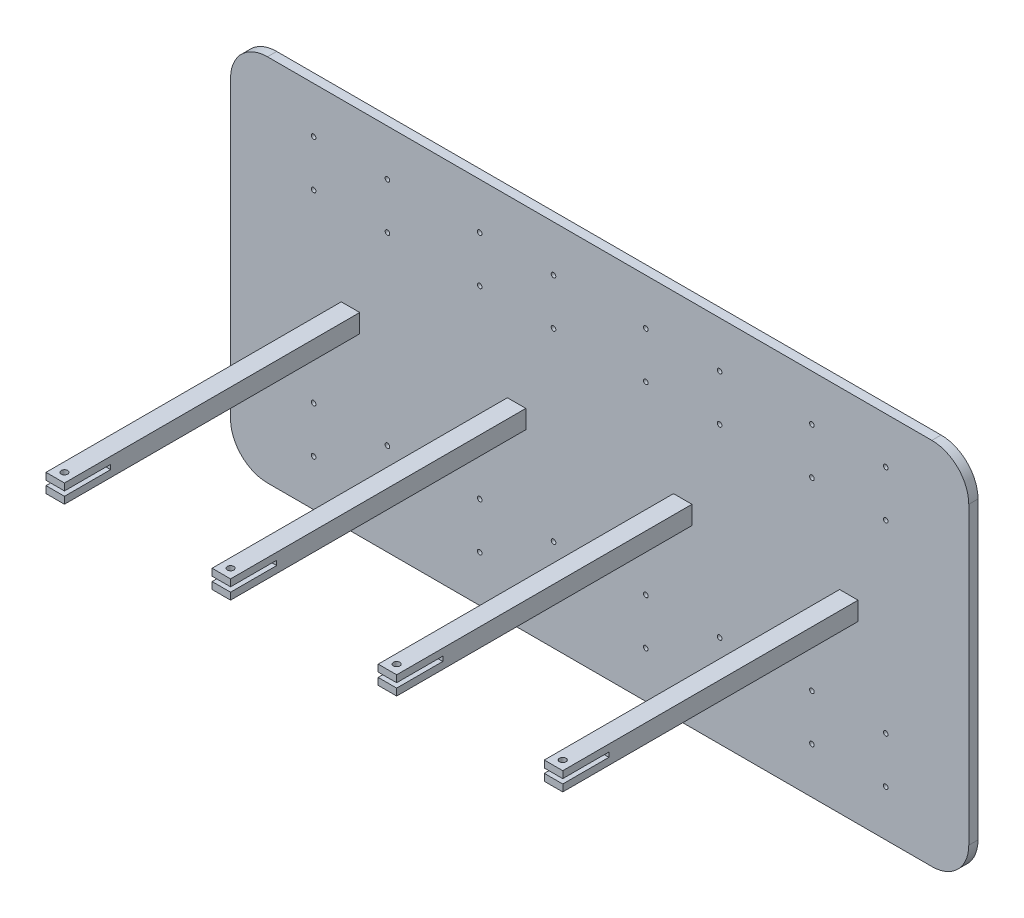
from build123d import *

# Parameters (mm, degrees)
SKETCH1_W             = 20
SKETCH1_H             = 20
SKETCH1_R             = 2.5
BOSS_EXTRUDE8_DEPTH   = 10
SKETCH1_12_W          = 20
SKETCH1_12_H          = 20
BOSS_EXTRUDE9_DEPTH   = 320
BOSS_EXTRUDE9_2_DEPTH = 320
BOSS_EXTRUDE9_3_DEPTH = 320
BOSS_EXTRUDE9_4_DEPTH = 320
SKETCH4_R             = 3.5
CUT_EXTRUDE14_DEPTH   = 210
SKETCH5_W             = 50
SKETCH5_H             = 5
CUT_EXTRUDE18_DEPTH   = 778.688883809


with BuildPart() as part:
    # Sketch1 → Boss-Extrude8 (new body)
    with BuildSketch(Plane.XY):
        with BuildLine():
            Line((360, 200), (-360, 200))
            ThreePointArc((-360, 200), (-388.284271247, 188.284271247), (-400, 160))
            Line((-400, 160), (-400, -160))
            ThreePointArc((-400, -160), (-388.284271247, -188.284271247), (-360, -200))
            Line((-360, -200), (360, -200))
            ThreePointArc((360, -200), (388.284271247, -188.284271247), (400, -160))
            Line((400, -160), (400, 160))
            ThreePointArc((400, 160), (388.284271247, 188.284271247), (360, 200))
        make_face()
        with Locations((-270, 0)):
            Rectangle(SKETCH1_W, SKETCH1_H, mode=Mode.SUBTRACT)
        with Locations((-90, 0)):
            Rectangle(SKETCH1_W, SKETCH1_H, mode=Mode.SUBTRACT)
        with Locations((90, 0)):
            Rectangle(SKETCH1_W, SKETCH1_H, mode=Mode.SUBTRACT)
        with Locations((270, 0)):
            Rectangle(SKETCH1_W, SKETCH1_H, mode=Mode.SUBTRACT)
        with Locations((-310, -150)):
            Circle(SKETCH1_R, mode=Mode.SUBTRACT)
        with Locations((-310, -100)):
            Circle(SKETCH1_R, mode=Mode.SUBTRACT)
        with Locations((-230, -150)):
            Circle(SKETCH1_R, mode=Mode.SUBTRACT)
        with Locations((-230, -100)):
            Circle(SKETCH1_R, mode=Mode.SUBTRACT)
        with Locations((-130, -150)):
            Circle(SKETCH1_R, mode=Mode.SUBTRACT)
        with Locations((-50, -150)):
            Circle(SKETCH1_R, mode=Mode.SUBTRACT)
        with Locations((-50, -100)):
            Circle(SKETCH1_R, mode=Mode.SUBTRACT)
        with Locations((-130, -100)):
            Circle(SKETCH1_R, mode=Mode.SUBTRACT)
        with Locations((50, -150)):
            Circle(SKETCH1_R, mode=Mode.SUBTRACT)
        with Locations((50, -100)):
            Circle(SKETCH1_R, mode=Mode.SUBTRACT)
        with Locations((130, -150)):
            Circle(SKETCH1_R, mode=Mode.SUBTRACT)
        with Locations((130, -100)):
            Circle(SKETCH1_R, mode=Mode.SUBTRACT)
        with Locations((230, -150)):
            Circle(SKETCH1_R, mode=Mode.SUBTRACT)
        with Locations((310, -150)):
            Circle(SKETCH1_R, mode=Mode.SUBTRACT)
        with Locations((310, -100)):
            Circle(SKETCH1_R, mode=Mode.SUBTRACT)
        with Locations((230, -100)):
            Circle(SKETCH1_R, mode=Mode.SUBTRACT)
        with Locations((-310, 100)):
            Circle(SKETCH1_R, mode=Mode.SUBTRACT)
        with Locations((-310, 150)):
            Circle(SKETCH1_R, mode=Mode.SUBTRACT)
        with Locations((-230, 100)):
            Circle(SKETCH1_R, mode=Mode.SUBTRACT)
        with Locations((-230, 150)):
            Circle(SKETCH1_R, mode=Mode.SUBTRACT)
        with Locations((-130, 100)):
            Circle(SKETCH1_R, mode=Mode.SUBTRACT)
        with Locations((-130, 150)):
            Circle(SKETCH1_R, mode=Mode.SUBTRACT)
        with Locations((-50, 100)):
            Circle(SKETCH1_R, mode=Mode.SUBTRACT)
        with Locations((-50, 150)):
            Circle(SKETCH1_R, mode=Mode.SUBTRACT)
        with Locations((50, 100)):
            Circle(SKETCH1_R, mode=Mode.SUBTRACT)
        with Locations((50, 150)):
            Circle(SKETCH1_R, mode=Mode.SUBTRACT)
        with Locations((130, 100)):
            Circle(SKETCH1_R, mode=Mode.SUBTRACT)
        with Locations((130, 150)):
            Circle(SKETCH1_R, mode=Mode.SUBTRACT)
        with Locations((230, 100)):
            Circle(SKETCH1_R, mode=Mode.SUBTRACT)
        with Locations((230, 150)):
            Circle(SKETCH1_R, mode=Mode.SUBTRACT)
        with Locations((310, 100)):
            Circle(SKETCH1_R, mode=Mode.SUBTRACT)
        with Locations((310, 150)):
            Circle(SKETCH1_R, mode=Mode.SUBTRACT)
    extrude(amount=-BOSS_EXTRUDE8_DEPTH)


with BuildPart() as body_2:
    # Sketch1<12> → Boss-Extrude9 (new body)
    with BuildSketch(Plane.XY):
        with Locations((270, 0)):
            Rectangle(SKETCH1_12_W, SKETCH1_12_H)
    extrude(amount=BOSS_EXTRUDE9_DEPTH)


with BuildPart() as body_3:
    # Sketch1<12> → Boss-Extrude9 2 (new body)
    with BuildSketch(Plane.XY):
        with Locations((90, 0)):
            Rectangle(SKETCH1_12_W, SKETCH1_12_H)
    extrude(amount=BOSS_EXTRUDE9_2_DEPTH)


with BuildPart() as body_4:
    # Sketch1<12> → Boss-Extrude9 3 (new body)
    with BuildSketch(Plane.XY):
        with Locations((-90, 0)):
            Rectangle(SKETCH1_12_W, SKETCH1_12_H)
    extrude(amount=BOSS_EXTRUDE9_3_DEPTH)


with BuildPart() as body_5:
    # Sketch1<12> → Boss-Extrude9 4 (new body)
    with BuildSketch(Plane.XY):
        with Locations((-270, 0)):
            Rectangle(SKETCH1_12_W, SKETCH1_12_H)
    extrude(amount=BOSS_EXTRUDE9_4_DEPTH)


with BuildPart() as cut_extrude14_tool:
    # Sketch4 → Cut-Extrude14 (new body)
    with BuildSketch(Plane.XZ.offset(10)):
        with Locations((-270, 310)):
            Circle(SKETCH4_R)
        with Locations((-90, 310)):
            Circle(SKETCH4_R)
        with Locations((90, 310)):
            Circle(SKETCH4_R)
        with Locations((270, 310)):
            Circle(SKETCH4_R)
    extrude(amount=-CUT_EXTRUDE14_DEPTH)


with BuildPart() as body_2_1:
    add(body_2.part)

    # Cut-Extrude14: cut by cut_extrude14_tool
    add(cut_extrude14_tool.part, mode=Mode.SUBTRACT)


with BuildPart() as body_3_1:
    add(body_3.part)

    # Cut-Extrude14: cut by cut_extrude14_tool
    add(cut_extrude14_tool.part, mode=Mode.SUBTRACT)


with BuildPart() as body_4_1:
    add(body_4.part)

    # Cut-Extrude14: cut by cut_extrude14_tool
    add(cut_extrude14_tool.part, mode=Mode.SUBTRACT)


with BuildPart() as body_5_1:
    add(body_5.part)

    # Cut-Extrude14: cut by cut_extrude14_tool
    add(cut_extrude14_tool.part, mode=Mode.SUBTRACT)


with BuildPart() as cut_extrude18_tool:
    # Sketch5 → Cut-Extrude18 (new, through all)
    with BuildSketch(Plane(origin=(280, 0, 0), x_dir=(0, 0, -1), z_dir=(1, 0, 0))):
        with Locations((-295, 0)):
            Rectangle(SKETCH5_W, SKETCH5_H)
    extrude(amount=-CUT_EXTRUDE18_DEPTH)


with BuildPart() as body_2_2:
    add(body_2_1.part)

    # Cut-Extrude18: cut by cut_extrude18_tool
    add(cut_extrude18_tool.part, mode=Mode.SUBTRACT)


with BuildPart() as body_3_2:
    add(body_3_1.part)

    # Cut-Extrude18: cut by cut_extrude18_tool
    add(cut_extrude18_tool.part, mode=Mode.SUBTRACT)


with BuildPart() as body_4_2:
    add(body_4_1.part)

    # Cut-Extrude18: cut by cut_extrude18_tool
    add(cut_extrude18_tool.part, mode=Mode.SUBTRACT)


with BuildPart() as body_5_2:
    add(body_5_1.part)

    # Cut-Extrude18: cut by cut_extrude18_tool
    add(cut_extrude18_tool.part, mode=Mode.SUBTRACT)


solid = Compound([part.part, body_2_2.part, body_3_2.part, body_4_2.part, body_5_2.part])
